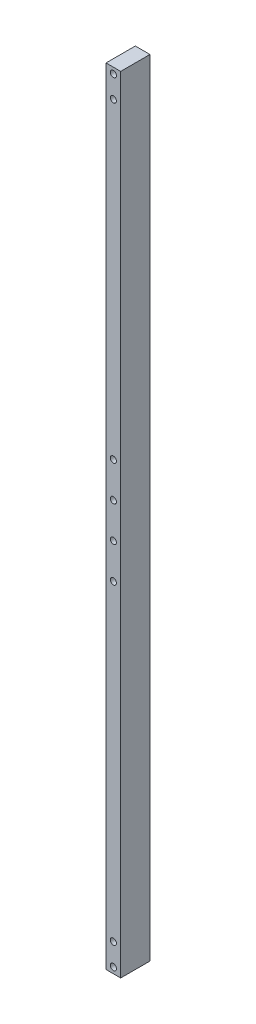
from build123d import *

# Parameters (mm, degrees)
SKETCH_1_W          = 10
SKETCH_1_H          = 20
EXTRUDE_1_DEPTH     = 600
SKETCH_6_W          = 20
SKETCH_6_H          = 10
CUT_EXTRUDE_4_DEPTH = 50
SKETCH_7_W          = 10
SKETCH_7_H          = 10
CUT_EXTRUDE_5_DEPTH = 82
SKETCH_2_R          = 2.1
CUT_EXTRUDE_6_DEPTH = 591.379293031
SKETCH_8_R          = 2.1
CUT_EXTRUDE_7_DEPTH = 54
SKETCH_9_W          = 10
SKETCH_9_H          = 22
CUT_EXTRUDE_8_DEPTH = 591.379293031


with BuildPart() as part:
    # 草图1 → 凸台-拉伸1 (new body)
    with BuildSketch(Plane(origin=(0, 0, 0), x_dir=(1, 0, 0), z_dir=(0, 1, 0))):
        with Locations((1.907216495, 4.819587629)):
            Rectangle(SKETCH_1_W, SKETCH_1_H)
    extrude(amount=EXTRUDE_1_DEPTH)

    # 草图6 → 切除-拉伸4 (cut)
    with BuildSketch(Plane(origin=(0, 0, -14.819587629), x_dir=(-1, 0, 0), z_dir=(0, 0, -1))):
        with Locations((3.092783505, 595)):
            Rectangle(SKETCH_6_W, SKETCH_6_H)
    extrude(amount=-CUT_EXTRUDE_4_DEPTH, mode=Mode.SUBTRACT)

    # 草图7 → 切除-拉伸5 (cut)
    with BuildSketch(Plane(origin=(0, 0, -14.819587629), x_dir=(-1, 0, 0), z_dir=(0, 0, -1))):
        with Locations((-1.907216495, 5)):
            Rectangle(SKETCH_7_W, SKETCH_7_H)
    extrude(amount=-CUT_EXTRUDE_5_DEPTH, mode=Mode.SUBTRACT)

    # 草图2 → 切除-拉伸6 (cut, through all)
    with BuildSketch(Plane.XY.offset(5.180412371)):
        with Locations((1.907216495, 264)):
            Circle(SKETCH_2_R)
        with Locations((1.907216495, 288)):
            Circle(SKETCH_2_R)
        with Locations(Location((1.907216495, 312, 0), (0, 0, 180))):
            Circle(SKETCH_2_R)
        with Locations(Location((1.907216495, 336, 0), (0, 0, 180))):
            Circle(SKETCH_2_R)
    extrude(amount=-CUT_EXTRUDE_6_DEPTH, mode=Mode.SUBTRACT)

    # 草图8 → 切除-拉伸7 (cut)
    with BuildSketch(Plane.XY.offset(5.180412371)):
        with Locations((1.907216495, 564)):
            Circle(SKETCH_8_R)
        with Locations((1.907216495, 549)):
            Circle(SKETCH_8_R)
        with Locations((1.907216495, 36)):
            Circle(SKETCH_8_R)
        with Locations((1.907216495, 51)):
            Circle(SKETCH_8_R)
        with Locations((1.907216495, 583)):
            Circle(SKETCH_8_R)
        with Locations((1.907216495, 17)):
            Circle(SKETCH_8_R)
    extrude(amount=-CUT_EXTRUDE_7_DEPTH, mode=Mode.SUBTRACT)

    # 草图9 → 切除-拉伸8 (cut, through all)
    with BuildSketch(Plane.XY.offset(5.180412371)):
        with Locations((1.907216495, 21)):
            Rectangle(SKETCH_9_W, SKETCH_9_H)
        with Locations((1.907216495, 579)):
            Rectangle(SKETCH_9_W, SKETCH_9_H)
    extrude(amount=-CUT_EXTRUDE_8_DEPTH, mode=Mode.SUBTRACT)


solid = part.part
